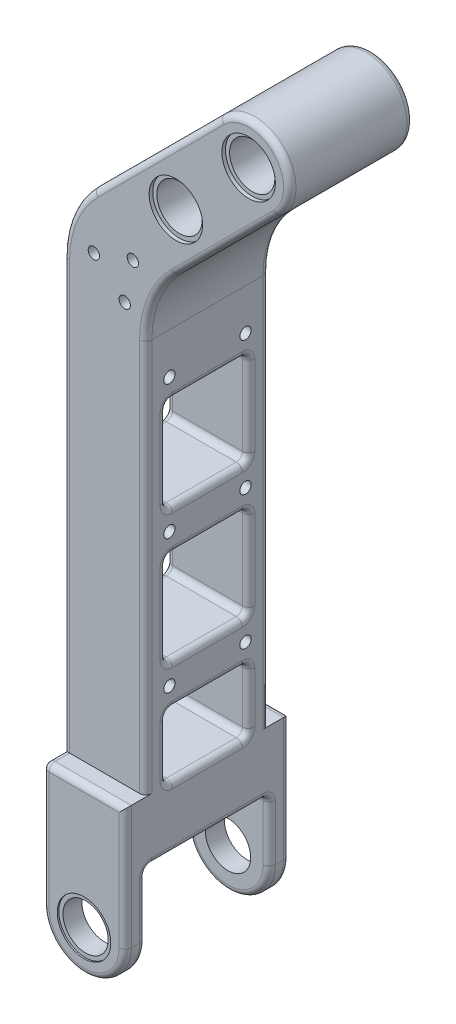
from build123d import *

# Parameters (mm, degrees)
SKETCH_1_R             = 20
SKETCH_1_R_2           = 11
EXTRUDE_1_DEPTH        = 60
EXTRUDE_2_DEPTH        = 30
SKETCH_4_R             = 11
EXTRUDE_3_DEPTH        = 10
SKETCH_8_R             = 11
CUT_EXTRUDE_1_DEPTH    = 100
FILLET_1_R             = 50
FILLET_2_R             = 3
SKETCH_9_R             = 13
CUT_EXTRUDE_2_DEPTH    = 0.75
CUT_EXTRUDE_START      = -0.75
SKETCH_10_R            = 13
CUT_EXTRUDE_3_DEPTH    = 0.75
SKETCH_11_R            = 2.75
CUT_EXTRUDE_4_DEPTH    = 393.300904947
SKETCH_12_W            = 40
SKETCH_12_H            = 45
SKETCH_12_H_2          = 31.005050634
CUT_EXTRUDE_5534_DEPTH = 393.300904947
FILLET_3_R             = 3
SKETCH_13_R            = 13
CUT_EXTRUDE_6_DEPTH    = 1.75
CUT_EXTRUDE_START_2    = -1.75
SKETCH_14_R            = 13
CUT_EXTRUDE_7_DEPTH    = 1.75
SKETCH_15_R            = 2.75
CUT_EXTRUDE_8_DEPTH    = 388.169213652


with BuildPart() as part:
    # 草图1 → 凸台-拉伸1 (new body)
    with BuildSketch(Plane.XY):
        Circle(SKETCH_1_R)
        Circle(SKETCH_1_R_2, mode=Mode.SUBTRACT)
    extrude(amount=EXTRUDE_1_DEPTH)

    # 草图2 → 凸台-拉伸2 (add, symmetric)
    with BuildSketch(Plane.XY.offset(30)):
        with BuildLine():
            Line((-14.142135624, 14.142135624), (-90, -61.715728753))
            Line((-90, -61.715728753), (-90, -320))
            Line((-90, -320), (-50, -320))
            Line((-50, -320), (-50, -78.284271247))
            Line((-50, -78.284271247), (14.142135624, -14.142135624))
            ThreePointArc((14.142135624, -14.142135624), (-14.142135624, -14.142135624), (-14.142135624, 14.142135624))
        make_face()
    extrude(amount=EXTRUDE_2_DEPTH, both=True)

    # 草图4 → 凸台-拉伸3 (add)
    with BuildSketch(Plane.XY.offset(60)):
        with BuildLine():
            Line((-90, -290), (-50, -290))
            Line((-50, -290), (-50, -350))
            ThreePointArc((-50, -350), (-70, -370), (-90, -350))
            Line((-90, -350), (-90, -290))
        make_face()
        with Locations((-70, -350)):
            Circle(SKETCH_4_R, mode=Mode.SUBTRACT)
    extrude_3 = extrude(amount=EXTRUDE_3_DEPTH)

    # 镜向1: 凸台-拉伸3 across plane
    add(extrude_3.mirror(Plane.XY.offset(30)))

    # 草图8 → 切除-拉伸1 (cut)
    with BuildSketch(Plane.XY.offset(60)):
        with Locations((-35.355339059, -35.355339059)):
            Circle(SKETCH_8_R)
    extrude(amount=-CUT_EXTRUDE_1_DEPTH, mode=Mode.SUBTRACT)

    # 圆角1
    fillet_1_edges = [part.edges().sort_by_distance(p)[0] for p in [
        (-50, -78.284271247, 30),
        (-90, -61.715728753, 30),
    ]]
    fillet(fillet_1_edges, radius=FILLET_1_R)

    # 圆角2
    fillet_2_edges = [part.edges().sort_by_distance(p)[0] for p in [
        (14.142135624, 14.142135624, 60),
        (14.142135624, 14.142135624, 0),
        (-10.606601718, -38.890872965, 60),
        (-44.748737342, -16.464466094, 0),
        (-70, -320, 0),
        (-90, -320, 30),
        (-50, -320, 30),
        (-44.748737342, -16.464466094, 60),
        (-70, -320, 60),
        (-10.606601718, -38.890872965, 0),
        (-90, -320, 70),
        (-70, -370, 70),
        (-50, -320, 70),
        (-70, -290, 70),
        (-90, -335, 60),
        (-90, -290, 65),
        (-70, -370, 60),
        (-50, -335, 60),
        (-90, -320, -10),
        (-70, -290, -10),
        (-90, -290, -5),
        (-50, -320, -10),
        (-70, -370, -10),
        (-90, -335, 0),
        (-70, -370, 0),
        (-50, -335, 0),
        (-90, -186.213203436, 0),
        (-90, -186.213203436, 60),
        (-50, -194.497474683, 0),
        (-86.193976626, -63.292235253, 0),
        (-50, -194.497474683, 60),
        (-86.193976626, -63.292235253, 60),
        (-46.193976626, -79.860777748, 0),
        (-46.193976626, -79.860777748, 60),
    ]]
    fillet(fillet_2_edges, radius=FILLET_2_R)

    # 草图9 → 切除-拉伸2 (cut)
    with BuildSketch(Plane.XY.offset(70)):
        with Locations((-70, -350)):
            Circle(SKETCH_9_R)
    extrude(amount=-CUT_EXTRUDE_2_DEPTH, mode=Mode.SUBTRACT)

    # 草图10 → 切除-拉伸3 (cut)
    with BuildSketch(Plane(origin=(0, 0, -10), x_dir=(-1, 0, 0), z_dir=(0, 0, -1)).offset(CUT_EXTRUDE_START)):
        with Locations(Location((70, -350, 0), (0, 0, 180))):
            Circle(SKETCH_10_R)
    extrude(amount=CUT_EXTRUDE_3_DEPTH, mode=Mode.SUBTRACT)

    # 草图11 → 切除-拉伸4 (cut, through all)
    with BuildSketch(Plane.ZY.offset(90)):
        with Locations(Location((48.5, -183.994949366, 0), (0, 0, 270))):
            Circle(SKETCH_11_R)
        with Locations(Location((48.5, -248.994949366, 0), (0, 0, 270))):
            Circle(SKETCH_11_R)
        with Locations(Location((48.5, -118.994949366, 0), (0, 0, 270))):
            Circle(SKETCH_11_R)
        with Locations(Location((11.5, -248.994949366, 0), (0, 0, 270))):
            Circle(SKETCH_11_R)
        with Locations(Location((11.5, -183.994949366, 0), (0, 0, 270))):
            Circle(SKETCH_11_R)
        with Locations(Location((11.5, -118.994949366, 0), (0, 0, 270))):
            Circle(SKETCH_11_R)
    extrude(amount=-CUT_EXTRUDE_4_DEPTH, mode=Mode.SUBTRACT)

    # 草图12 → Cut-Extrude 5534 (cut, through all)
    with BuildSketch(Plane.ZY.offset(90)):
        with Locations((30, -151.494949366)):
            Rectangle(SKETCH_12_W, SKETCH_12_H)
        with Locations((30, -216.494949366)):
            Rectangle(SKETCH_12_W, SKETCH_12_H)
        with Locations((30, -274.497474683)):
            Rectangle(SKETCH_12_W, SKETCH_12_H_2)
    extrude(amount=-CUT_EXTRUDE_5534_DEPTH, mode=Mode.SUBTRACT)

    # 圆角3
    fillet_3_edges = [part.edges().sort_by_distance(p)[0] for p in [
        (-50, -216.494949366, 10),
        (-50, -238.994949366, 30),
        (-50, -216.494949366, 50),
        (-50, -193.994949366, 30),
        (-50, -274.497474683, 10),
        (-50, -290, 30),
        (-50, -274.497474683, 50),
        (-50, -258.994949366, 30),
        (-50, -151.494949366, 50),
        (-50, -128.994949366, 30),
        (-50, -151.494949366, 10),
        (-50, -173.994949366, 30),
        (-70, -173.994949366, 50),
        (-70, -173.994949366, 10),
        (-70, -128.994949366, 10),
        (-90, -128.994949366, 30),
        (-70, -128.994949366, 50),
        (-90, -151.494949366, 50),
        (-90, -173.994949366, 30),
        (-90, -151.494949366, 10),
        (-70, -258.994949366, 10),
        (-90, -258.994949366, 30),
        (-70, -258.994949366, 50),
        (-90, -274.497474683, 50),
        (-70, -290, 50),
        (-70, -290, 10),
        (-90, -274.497474683, 10),
        (-90, -290, 30),
        (-70, -193.994949366, 10),
        (-90, -193.994949366, 30),
        (-70, -193.994949366, 50),
        (-90, -216.494949366, 50),
        (-70, -238.994949366, 50),
        (-70, -238.994949366, 10),
        (-90, -216.494949366, 10),
        (-90, -238.994949366, 30),
    ]]
    fillet(fillet_3_edges, radius=FILLET_3_R)

    # 草图13 → 切除-拉伸6 (cut)
    with BuildSketch(Plane.XY.offset(60)):
        Circle(SKETCH_13_R)
        with Locations((-35.355339059, -35.355339059)):
            Circle(SKETCH_13_R)
    extrude(amount=-CUT_EXTRUDE_6_DEPTH, mode=Mode.SUBTRACT)

    # 草图14 → 切除-拉伸7 (cut)
    with BuildSketch(Plane(origin=(0, 0, 0), x_dir=(-1, 0, 0), z_dir=(0, 0, -1)).offset(CUT_EXTRUDE_START_2)):
        with Locations(Location((0, 0, 0), (0, 0, 180))):
            Circle(SKETCH_14_R)
        with Locations(Location((35.355339059, -35.355339059, 0), (0, 0, 180))):
            Circle(SKETCH_14_R)
    extrude(amount=CUT_EXTRUDE_7_DEPTH, mode=Mode.SUBTRACT)

    # 草图15 → 切除-拉伸8 (cut, through all)
    with BuildSketch(Plane(origin=(0, 0, 0), x_dir=(-1, 0, 0), z_dir=(0, 0, -1))):
        with Locations((60.194193243, -86.812146645)):
            Circle(SKETCH_15_R)
        with Locations((56.27187054, -67.200533131)):
            Circle(SKETCH_15_R)
        with Locations((75.217187404, -73.609508785)):
            Circle(SKETCH_15_R)
    extrude(amount=-CUT_EXTRUDE_8_DEPTH, mode=Mode.SUBTRACT)


solid = part.part
